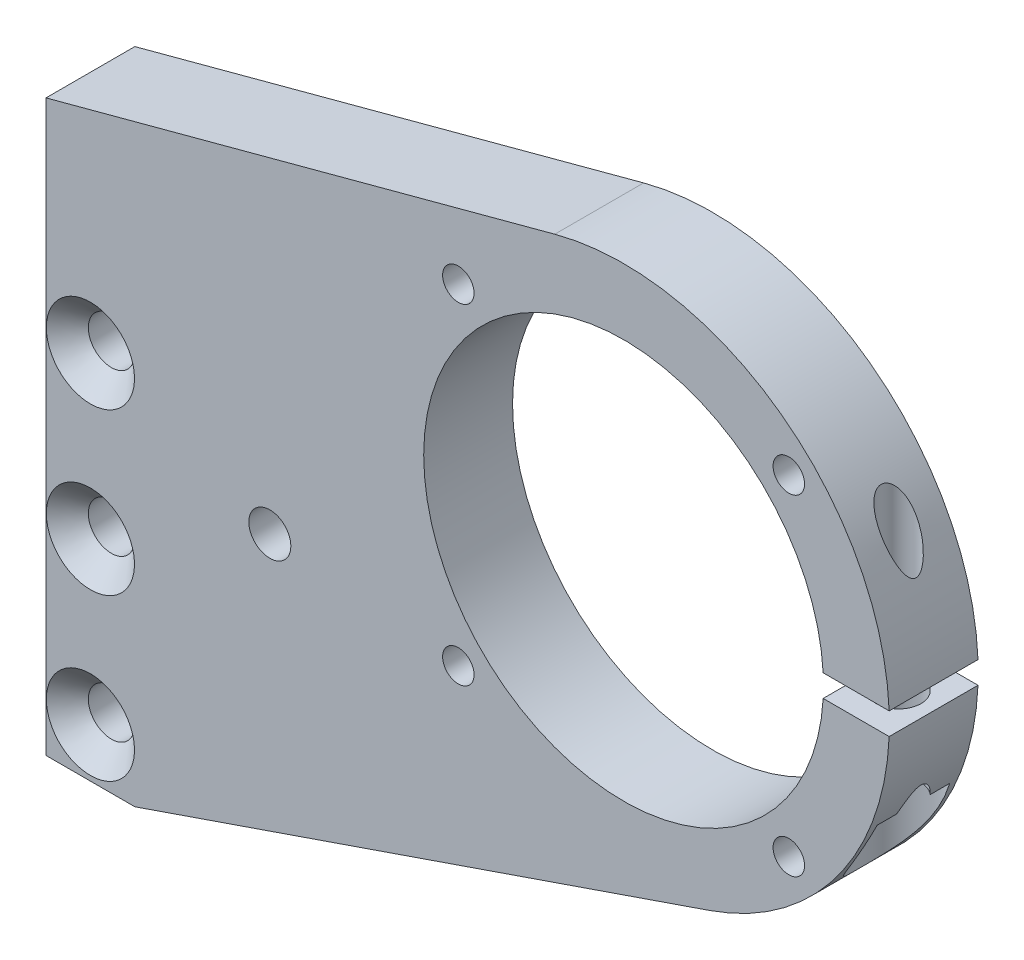
from build123d import *

# Parameters (mm, degrees)
BOSS_EXTRUDE1_DEPTH        = 12.7
CUT_EXTRUDE1_DEPTH         = 270.19769127
SKETCH3_W                  = 28.575
SKETCH3_H                  = 12.7
F_8_CLEARANCE_HOLE1_D      = 4.5
F_1_4_CLEARANCE_HOLE1_D    = 6.6
F_12_CLEARANCE_HOLE1_D     = 6
HOLE1_D                    = 6.4
HOLE1_DEPTH                = 24.77643101
HOLE1_CBORE_D              = 11.2
HOLE1_CBORE_DEPTH          = 11.77643101
F_10_CLEARANCE_HOLE1_D     = 5
F_10_CLEARANCE_HOLE1_DEPTH = 36.4125
CHAMFER1_SIZE              = 3
SKETCH14_R                 = 4
SKETCH14_R_2               = 3
BOSS_EXTRUDE2_DEPTH        = 12.7
SKETCH_1_W                 = 136.102443729
SKETCH_1_H                 = 34.650666972
CUT_EXTRUDE_1_DEPTH        = 248.673656649


with BuildPart() as part:
    # Sketch1 → Boss-Extrude1 (new body)
    with BuildSketch(Plane(origin=(0, 0, 0), x_dir=(-1, 0, 0), z_dir=(0, 0, -1))):
        with BuildLine():
            Line((224.169455465, 127.72254562), (151.435240745, 147.211619716))
            ThreePointArc((151.435240745, 147.211619716), (105.257753851, 121.607458019), (129.246532787, 74.570537656))
            Line((129.246532787, 74.570537656), (211.469455465, 46.304993078))
            Line((211.469455465, 46.304993078), (224.169455465, 46.304993078))
            Line((224.169455465, 46.304993078), (224.169455465, 127.72254562))
        make_face()
    extrude(amount=-BOSS_EXTRUDE1_DEPTH)

    # Sketch2 → Cut-Extrude1 (cut, through all)
    with BuildSketch(Plane.XY.offset(12.7)):
        with BuildLine():
            Line((-103.633291463, 112.093938317), (-113.179018515, 112.093938317))
            ThreePointArc((-113.179018515, 112.093938317), (-113.134717032, 110.506438317), (-113.179018515, 108.918938317))
            Line((-113.179018515, 108.918938317), (-103.633291463, 108.918938317))
            ThreePointArc((-103.633291463, 108.918938317), (-103.600117032, 110.506438317), (-103.633291463, 112.093938317))
        make_face()
    extrude(amount=-CUT_EXTRUDE1_DEPTH, mode=Mode.SUBTRACT)

    # Sketch3 → Cut-Revolve1 (revolve, cut)
    with BuildSketch(Plane(origin=(0, 110.506438317, 0), x_dir=(1, 0, 0), z_dir=(0, 1, 0))):
        with Locations((-127.312617032, -6.35)):
            Rectangle(SKETCH3_W, SKETCH3_H)
    revolve(axis=Axis((-141.600117032, 110.506438317, 0), (0, 0, 1)), mode=Mode.SUBTRACT)

    # #8 Clearance Hole1 (through all)
    with Locations(Plane.XY.offset(12.7)):
        with Locations((-117.978117032, 86.884438317), (-165.222117032, 86.884438317), (-165.222117032, 134.128438317), (-117.978117032, 134.128438317)):
            Hole(F_8_CLEARANCE_HOLE1_D / 2)

    # 1/4 Clearance Hole1 (through all)
    with Locations(Plane(origin=(0, 0, 0), x_dir=(-1, 0, 0), z_dir=(0, 0, -1))):
        with Locations((217.819455465, 53.304993078), (217.819455465, 76.304993078), (217.819455465, 99.304993078)):
            Hole(F_1_4_CLEARANCE_HOLE1_D / 2)

    # #12 Clearance Hole1 (through all)
    with Locations(Plane.XY.offset(12.7)):
        with Locations((-192.169455465, 89.72254562)):
            Hole(F_12_CLEARANCE_HOLE1_D / 2)

    # Hole1
    with Locations(Plane(origin=(0, 84.142507307, 0), x_dir=(-1, 0, 0), z_dir=(0, -1, 0))):
        with Locations((108.633291463, -6.35)):
            CounterBoreHole(HOLE1_D / 2, HOLE1_CBORE_D / 2, HOLE1_CBORE_DEPTH, depth=HOLE1_DEPTH)

    # #10 Clearance Hole1
    with Locations(Plane(origin=(0, 112.093938317, 0), x_dir=(-1, 0, 0), z_dir=(0, -1, 0))):
        with Locations((108.633291463, -6.35)):
            Hole(F_10_CLEARANCE_HOLE1_D / 2, depth=F_10_CLEARANCE_HOLE1_DEPTH)

    # Chamfer1
    chamfer1_edges = [part.edges().sort_by_distance(p)[0] for p in [
        (-221.119455465, 99.304993078, 0),
        (-221.119455465, 76.304993078, 0),
        (-221.119455465, 53.304993078, 0),
    ]]
    chamfer(chamfer1_edges, length=CHAMFER1_SIZE)

    # Sketch14 → Boss-Extrude2 (add)
    with BuildSketch(Plane(origin=(0, 0, 0), x_dir=(-1, 0, 0), z_dir=(0, 0, -1))):
        with Locations((192.169455465, 89.72254562)):
            Circle(SKETCH14_R)
        with Locations(Location((192.169455465, 89.72254562, 0), (0, 0, 180))):
            Circle(SKETCH14_R_2, mode=Mode.SUBTRACT)
    extrude(amount=-BOSS_EXTRUDE2_DEPTH)

    # 镜向1: part across plane


with BuildPart() as part_1:
    add(part.part)
    add(part.part.mirror(Plane(origin=(-141.600117032, 110.506438317, 12.7), x_dir=(1, 0, 0), z_dir=(0, 0, -1))))

    # 草图1 → 切除-拉伸1 (cut, through all)
    with BuildSketch(Plane.XZ.offset(-46.304993078)):
        with Locations((-156.118233601, -4.625333486)):
            Rectangle(SKETCH_1_W, SKETCH_1_H)
    extrude(amount=-CUT_EXTRUDE_1_DEPTH, mode=Mode.SUBTRACT)


solid = part_1.part
